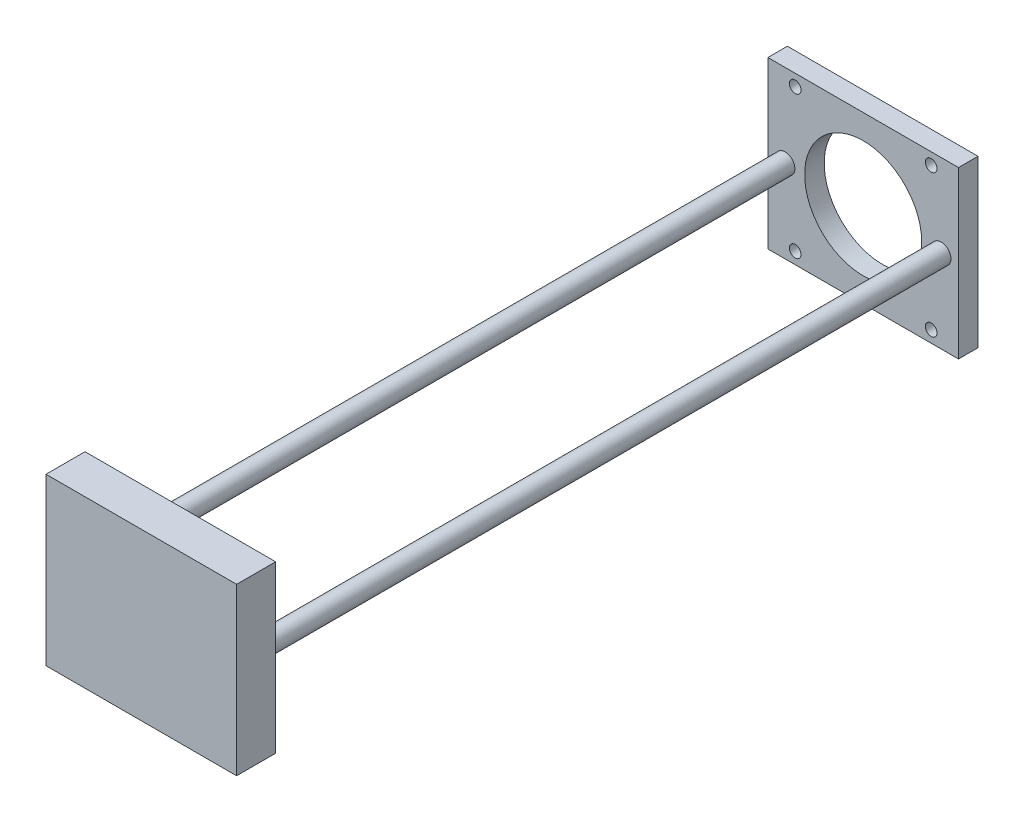
from build123d import *

# Parameters (mm, degrees)
CROQUIS1_W              = 97.7
CROQUIS1_H              = 85
CROQUIS1_R              = 3
CROQUIS1_R_2            = 30
SALIENTE_EXTRUIR1_DEPTH = 10
CROQUIS2_R              = 5
SALIENTE_EXTRUIR2_DEPTH = 350
CROQUIS3_W              = 97.7
CROQUIS3_H              = 85
SALIENTE_EXTRUIR3_DEPTH = 20


with BuildPart() as part:
    # Croquis1 → Saliente-Extruir1 (new body)
    with BuildSketch(Plane.XY):
        Rectangle(CROQUIS1_W, CROQUIS1_H)
        with Locations((-34.85, 36.5)):
            Circle(CROQUIS1_R, mode=Mode.SUBTRACT)
        Circle(CROQUIS1_R_2, mode=Mode.SUBTRACT)
        with Locations(Location((34.85, 36.5, 0), (0, 0, 180))):
            Circle(CROQUIS1_R, mode=Mode.SUBTRACT)
        with Locations((34.85, -36.5)):
            Circle(CROQUIS1_R, mode=Mode.SUBTRACT)
        with Locations(Location((-34.85, -36.5, 0), (0, 0, 180))):
            Circle(CROQUIS1_R, mode=Mode.SUBTRACT)
    extrude(amount=SALIENTE_EXTRUIR1_DEPTH)

    # Croquis2 → Saliente-Extruir2 (add)
    with BuildSketch(Plane.XY.offset(10)):
        with Locations((-40, 0)):
            Circle(CROQUIS2_R)
        with Locations(Location((40, 0, 0), (0, 0, 180))):
            Circle(CROQUIS2_R)
    extrude(amount=SALIENTE_EXTRUIR2_DEPTH)

    # Croquis3 → Saliente-Extruir3 (add)
    with BuildSketch(Plane.XY.offset(360)):
        Rectangle(CROQUIS3_W, CROQUIS3_H)
    extrude(amount=SALIENTE_EXTRUIR3_DEPTH)


solid = part.part
